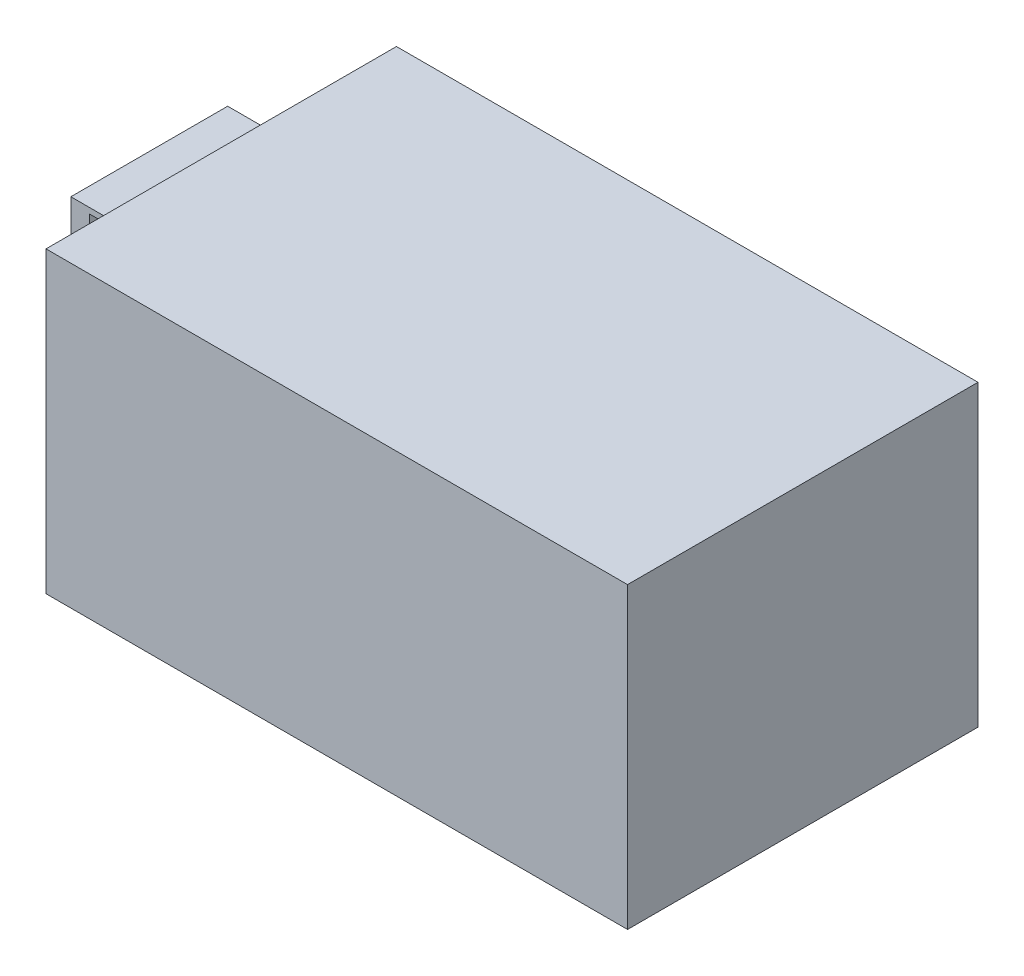
from build123d import *

# Parameters (mm, degrees)
SKETCH1_W           = 77.879871538
SKETCH1_H           = 46.933470971
BOSS_EXTRUDE1_DEPTH = 40
SKETCH7_W           = 38
SKETCH7_H           = 21
BOSS_EXTRUDE3_DEPTH = 30
SKETCH8_W           = 40
SKETCH8_H           = 28.5
CUT_EXTRUDE1_DEPTH  = 50


with BuildPart() as part:
    # Sketch1 → Boss-Extrude1 (new body)
    with BuildSketch(Plane(origin=(0, 0, 0), x_dir=(1, 0, 0), z_dir=(0, 1, 0))):
        with Locations((0.22838672, 1.7129004)):
            Rectangle(SKETCH1_W, SKETCH1_H)
    extrude(amount=BOSS_EXTRUDE1_DEPTH)


with BuildPart() as body_2:
    # Sketch7 → Boss-Extrude3 (new body)
    with BuildSketch(Plane(origin=(0, 0, 0), x_dir=(1, 0, 0), z_dir=(0, 1, 0))):
        with Locations((-34.090526118, 6.455021393)):
            Rectangle(SKETCH7_W, SKETCH7_H)
    extrude(amount=BOSS_EXTRUDE3_DEPTH)

    # Sketch8 → Cut-Extrude1 (cut)
    with BuildSketch(Plane.XY.offset(4.044978607)):
        with Locations((-30.590526118, 15)):
            Rectangle(SKETCH8_W, SKETCH8_H)
    extrude(amount=-CUT_EXTRUDE1_DEPTH, mode=Mode.SUBTRACT)


solid = Compound([part.part, body_2.part])
